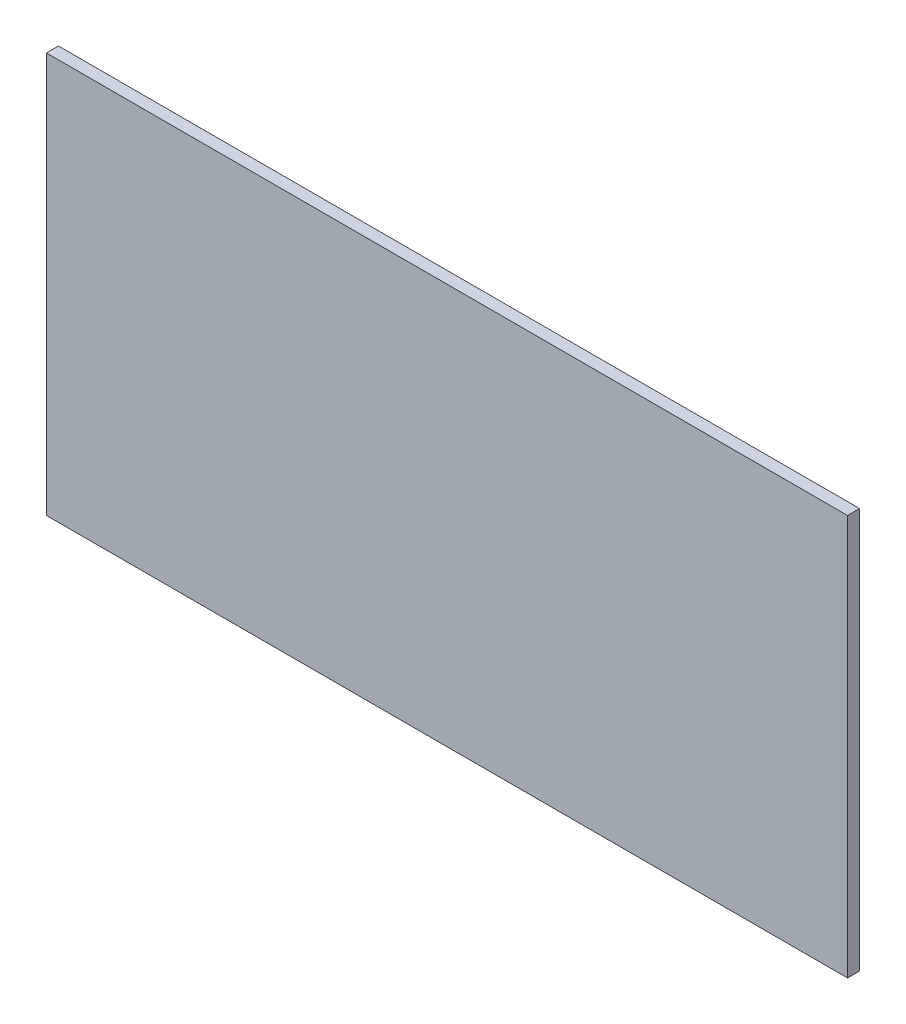
from build123d import *

# Parameters (mm, degrees)
SKETCH1_W           = 100
SKETCH1_H           = 50
BOSS_EXTRUDE1_DEPTH = 1.5


with BuildPart() as part:
    # Sketch1 → Boss-Extrude1 (new body)
    with BuildSketch(Plane.XY):
        with Locations((-50, -25)):
            Rectangle(SKETCH1_W, SKETCH1_H)
    extrude(amount=BOSS_EXTRUDE1_DEPTH)


solid = part.part
